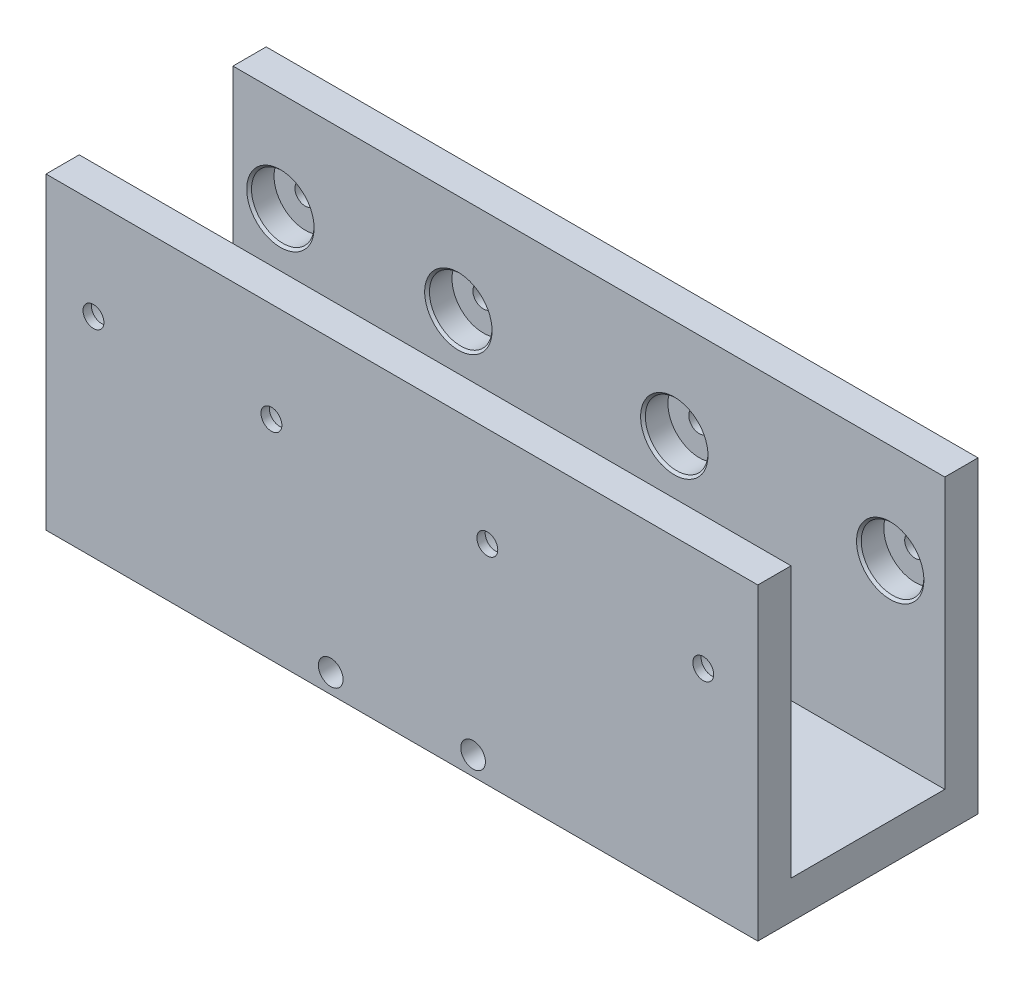
from build123d import *

# Parameters (mm, degrees)
SKETCH1_W           = 150
SKETCH1_H           = 65
BOSS_EXTRUDE1_DEPTH = 7
CUT_EXTRUDE1_REACH  = 165.628
SKETCH2_R           = 2.2
SKETCH3_W           = 150
SKETCH3_H           = 8
BOSS_EXTRUDE2_DEPTH = 16.2
SKETCH4_R           = 6.6
CUT_EXTRUDE2_DEPTH  = 5.25
CHAMFER1_SIZE       = 0.5
SKETCH5_R           = 2.6
CUT_EXTRUDE3_DEPTH  = 7
SKETCH7_R           = 1.5
CUT_EXTRUDE4_DEPTH  = 169.158734534


with BuildPart() as part:
    # Sketch1 → Boss-Extrude1 (new body)
    with BuildSketch(Plane.XY):
        with Locations((75, 32.5)):
            Rectangle(SKETCH1_W, SKETCH1_H)
    boss_extrude1 = extrude(amount=BOSS_EXTRUDE1_DEPTH)

    # Sketch2 → Cut-Extrude1 (cut, up to next)
    with BuildSketch(Plane.XY.offset(7), mode=Mode.PRIVATE) as cut_extrude1_sk1:
        with Locations((10, 44)):
            Circle(SKETCH2_R)
    cut_extrude1_tool1 = extrude(cut_extrude1_sk1.sketch, amount=-CUT_EXTRUDE1_REACH, mode=Mode.PRIVATE) & part.part
    # Sketch2 → Cut-Extrude1 (cut, up to next)
    with BuildSketch(Plane.XY.offset(7), mode=Mode.PRIVATE) as cut_extrude1_sk2:
        with Locations((47.5, 44)):
            Circle(SKETCH2_R)
    cut_extrude1_tool2 = extrude(cut_extrude1_sk2.sketch, amount=-CUT_EXTRUDE1_REACH, mode=Mode.PRIVATE) & part.part
    # Sketch2 → Cut-Extrude1 (cut, up to next)
    with BuildSketch(Plane.XY.offset(7), mode=Mode.PRIVATE) as cut_extrude1_sk3:
        with Locations((93, 44)):
            Circle(SKETCH2_R)
    cut_extrude1_tool3 = extrude(cut_extrude1_sk3.sketch, amount=-CUT_EXTRUDE1_REACH, mode=Mode.PRIVATE) & part.part
    # Sketch2 → Cut-Extrude1 (cut, up to next)
    with BuildSketch(Plane.XY.offset(7), mode=Mode.PRIVATE) as cut_extrude1_sk4:
        with Locations((138.5, 44)):
            Circle(SKETCH2_R)
    cut_extrude1_tool4 = extrude(cut_extrude1_sk4.sketch, amount=-CUT_EXTRUDE1_REACH, mode=Mode.PRIVATE) & part.part
    cut_extrude1_1 = cut_extrude1_tool1.solids().sort_by_distance((10, 44, 7))[0]
    add(cut_extrude1_1, mode=Mode.SUBTRACT)
    cut_extrude1_2 = cut_extrude1_tool2.solids().sort_by_distance((47.5, 44, 7))[0]
    add(cut_extrude1_2, mode=Mode.SUBTRACT)
    cut_extrude1_3 = cut_extrude1_tool3.solids().sort_by_distance((93, 44, 7))[0]
    add(cut_extrude1_3, mode=Mode.SUBTRACT)
    cut_extrude1_4 = cut_extrude1_tool4.solids().sort_by_distance((138.5, 44, 7))[0]
    add(cut_extrude1_4, mode=Mode.SUBTRACT)
    cut_extrude1 = cut_extrude1_1 + cut_extrude1_2 + cut_extrude1_3 + cut_extrude1_4  # Cut-Extrude1 as one shape, for the pattern or mirror that repeats it

    # Sketch3 → Boss-Extrude2 (add)
    with BuildSketch(Plane(origin=(0, 0, 0), x_dir=(-1, 0, 0), z_dir=(0, 0, -1))):
        with Locations((-75, 4)):
            Rectangle(SKETCH3_W, SKETCH3_H)
    boss_extrude2 = extrude(amount=BOSS_EXTRUDE2_DEPTH)

    # Sketch4 → Cut-Extrude2 (cut)
    with BuildSketch(Plane(origin=(0, 0, 0), x_dir=(-1, 0, 0), z_dir=(0, 0, -1))):
        with Locations((-138.5, 44)):
            Circle(SKETCH4_R)
        with Locations((-93, 44)):
            Circle(SKETCH4_R)
        with Locations((-47.5, 44)):
            Circle(SKETCH4_R)
        with Locations((-10, 44)):
            Circle(SKETCH4_R)
    cut_extrude2 = extrude(amount=-CUT_EXTRUDE2_DEPTH, mode=Mode.SUBTRACT)

    # Mirror2: Boss-Extrude2 across plane
    add(boss_extrude2.mirror(Plane.XY.offset(-16.2)))

    # Mirror3: Boss-Extrude1, Cut-Extrude1, Cut-Extrude2 across plane
    add(boss_extrude1.mirror(Plane(origin=(0, 0, -16.2), x_dir=(1, 0, 0), z_dir=(0, 0, -1))))
    add(cut_extrude1.mirror(Plane(origin=(0, 0, -16.2), x_dir=(1, 0, 0), z_dir=(0, 0, -1))), mode=Mode.SUBTRACT)
    add(cut_extrude2.mirror(Plane(origin=(0, 0, -16.2), x_dir=(1, 0, 0), z_dir=(0, 0, -1))), mode=Mode.SUBTRACT)

    # Chamfer1
    chamfer1_edges = [part.edges().sort_by_distance(p)[0] for p in [
        (145.1, 44, -32.4),
        (99.6, 44, -32.4),
        (54.1, 44, -32.4),
        (16.6, 44, -32.4),
        (145.1, 44, 0),
        (99.6, 44, 0),
        (54.1, 44, 0),
        (16.6, 44, 0),
    ]]
    chamfer(chamfer1_edges, length=CHAMFER1_SIZE)

    # Sketch5 → Cut-Extrude3 (cut)
    with BuildSketch(Plane.XY.offset(7)):
        with Locations((60.000022648, 4.052132501)):
            Circle(SKETCH5_R)
        with Locations((89.999977352, 4)):
            Circle(SKETCH5_R)
    extrude(amount=-CUT_EXTRUDE3_DEPTH, mode=Mode.SUBTRACT)

    # Sketch7 → Cut-Extrude4 (cut, through all)
    with BuildSketch(Plane.XY):
        with Locations((60.000022648, 4.052132501)):
            Circle(SKETCH7_R)
        with Locations((89.999977352, 4)):
            Circle(SKETCH7_R)
    extrude(amount=-CUT_EXTRUDE4_DEPTH, mode=Mode.SUBTRACT)


solid = part.part
